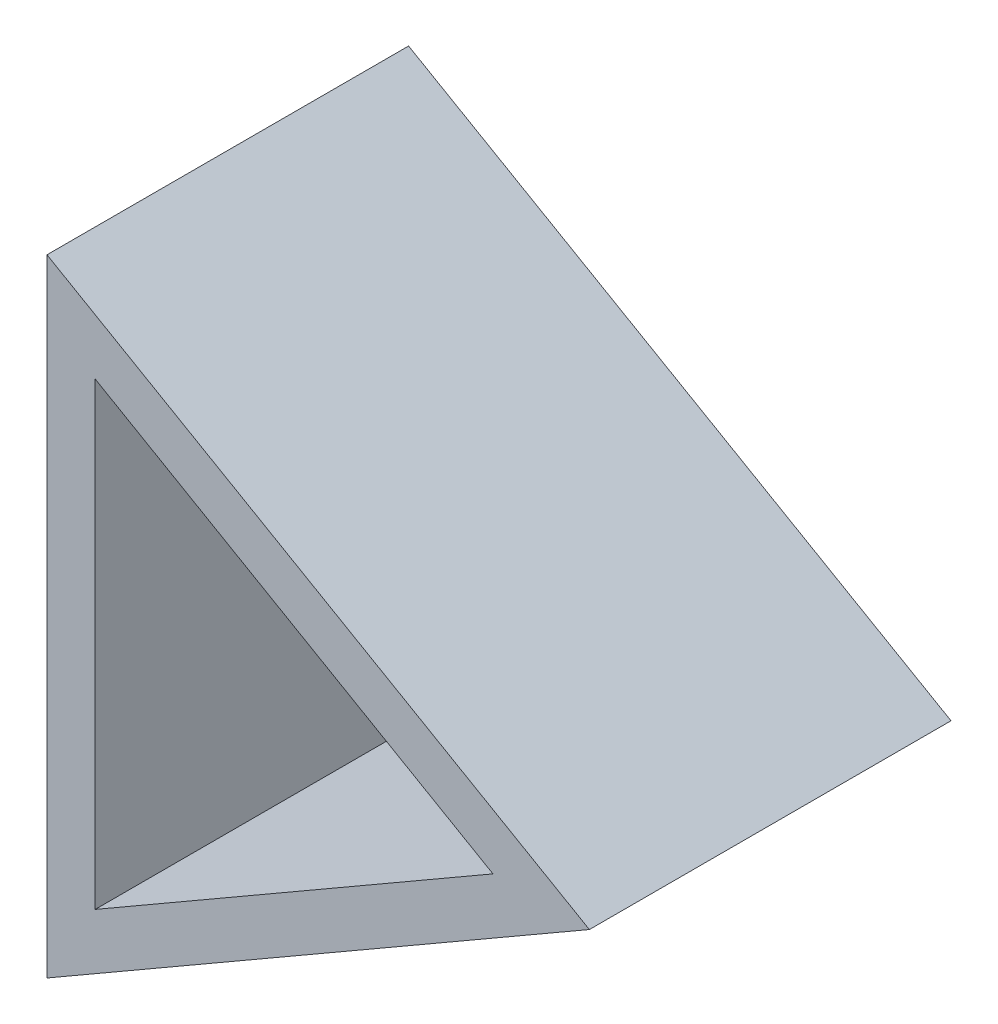
from build123d import *

# Parameters (mm, degrees)
EXTRUDE_1_DEPTH = 15
SHELL_1_T       = -4


with BuildPart() as part:
    # 草图1 → 凸台-拉伸1 (new, symmetric)
    with BuildSketch(Plane.XY):
        Polygon((30, 0), (-15, 25.980762114), (-15, -25.980762114), align=None)
    extrude(amount=EXTRUDE_1_DEPTH, both=True)

    # 抽壳1
    shell_1_openings = [part.faces().sort_by_distance(p)[0] for p in [
        (0, 0, 15),
    ]]
    offset(amount=SHELL_1_T, openings=shell_1_openings, kind=Kind.INTERSECTION)


solid = part.part
